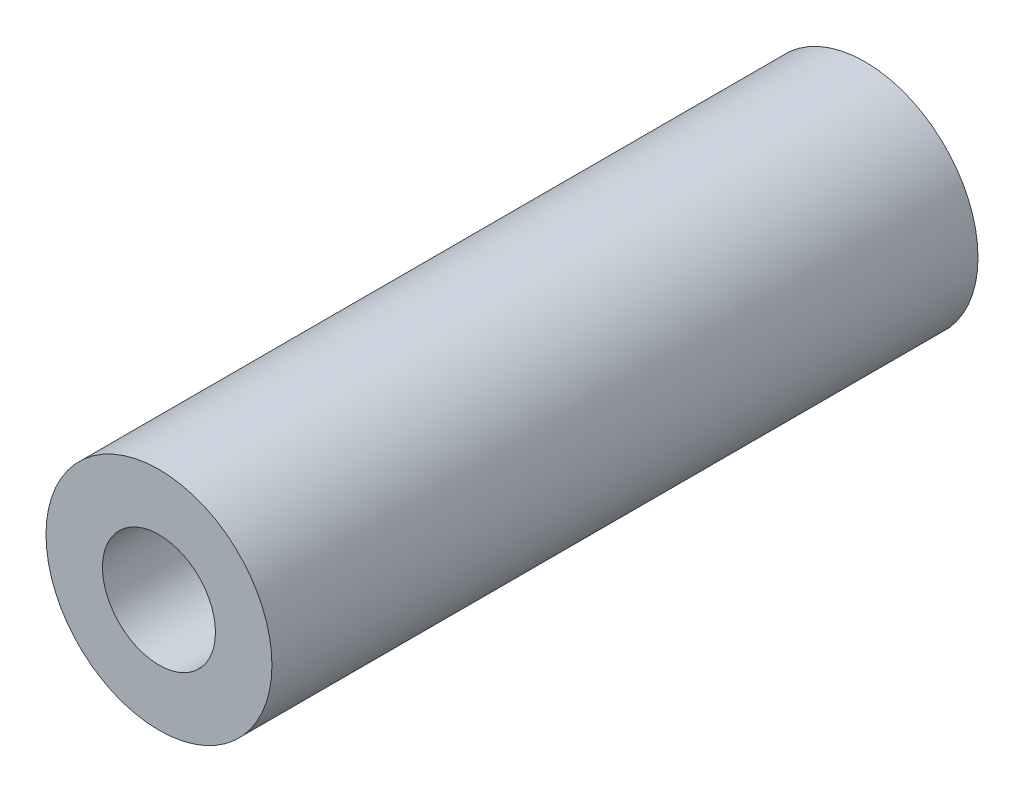
from build123d import *

# Parameters (mm, degrees)
SKETCH_1_R      = 4
SKETCH_1_R_2    = 2
EXTRUDE_1_DEPTH = 12.5


with BuildPart() as part:
    # 草图1 → 凸台-拉伸1 (new, symmetric)
    with BuildSketch(Plane.XY):
        Circle(SKETCH_1_R)
        Circle(SKETCH_1_R_2, mode=Mode.SUBTRACT)
    extrude(amount=EXTRUDE_1_DEPTH, both=True)


solid = part.part
